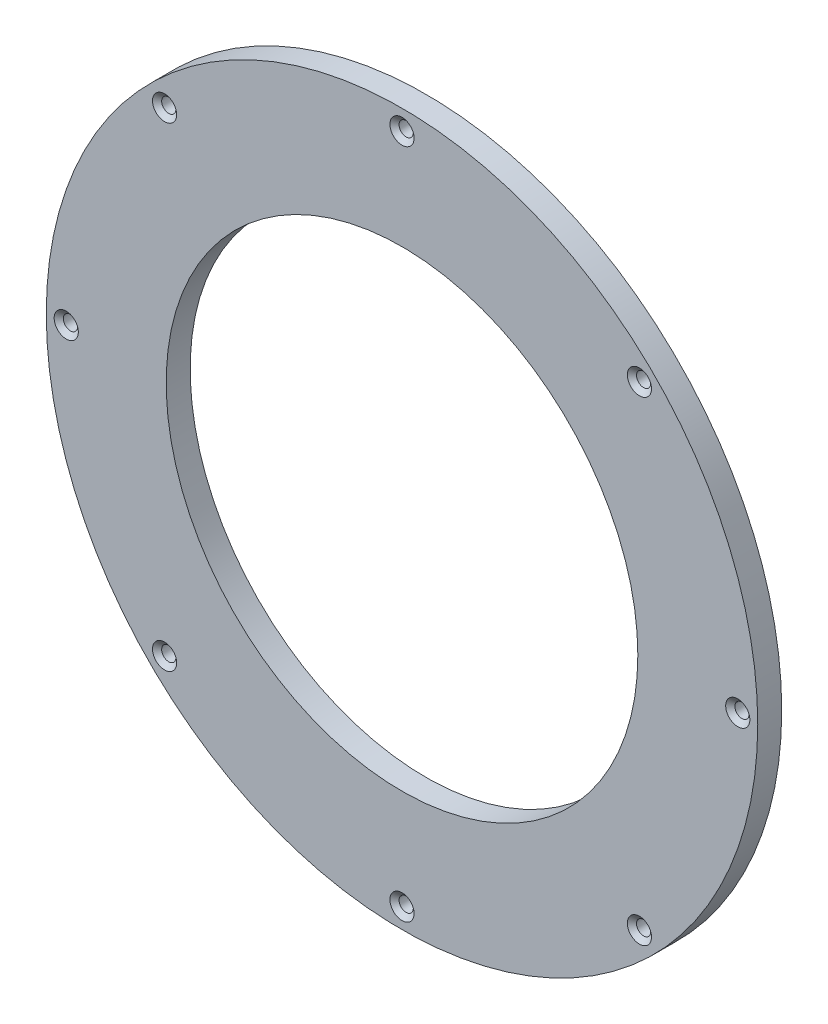
from build123d import *

# Parameters (mm, degrees)
SKETCH1_R                                         = 44.5
BOSS_EXTRUDE1_DEPTH                               = 3
SKETCH2_R                                         = 29.5
CUT_EXTRUDE1_DEPTH                                = 3
CSK_FOR_0_FLAT_HEAD_MACHINE_SCREW_100_D           = 1.778
CSK_FOR_0_FLAT_HEAD_MACHINE_SCREW_100_CSINK_D     = 3.0226
CSK_FOR_0_FLAT_HEAD_MACHINE_SCREW_100_CSINK_ANGLE = 100
CIRPATTERN1_COUNT                                 = 8


with BuildPart() as part:
    # Sketch1 → Boss-Extrude1 (new body)
    with BuildSketch(Plane.XY):
        Circle(SKETCH1_R)
    extrude(amount=BOSS_EXTRUDE1_DEPTH)

    # Sketch2 → Cut-Extrude1 (cut)
    with BuildSketch(Plane.XY.offset(3)):
        Circle(SKETCH2_R)
    extrude(amount=-CUT_EXTRUDE1_DEPTH, mode=Mode.SUBTRACT)

    # CSK for #0 Flat Head Machine Screw (100)1 (through all)
    with Locations(Plane.XY.offset(3)):
        with Locations((0, 42)):
            csk_for_0_flat_head_machine_screw_100 = CounterSinkHole(CSK_FOR_0_FLAT_HEAD_MACHINE_SCREW_100_D / 2, CSK_FOR_0_FLAT_HEAD_MACHINE_SCREW_100_CSINK_D / 2, counter_sink_angle=CSK_FOR_0_FLAT_HEAD_MACHINE_SCREW_100_CSINK_ANGLE)

    # CirPattern1: CSK for #0 Flat Head Machine Screw (100)1 ×8 about axis
    cirpattern1_axis = Axis((0, 0, 0), (0, 0, 1))
    for i in range(1, CIRPATTERN1_COUNT):
        add(csk_for_0_flat_head_machine_screw_100.rotate(cirpattern1_axis, i * 360 / CIRPATTERN1_COUNT), mode=Mode.SUBTRACT)


solid = part.part
